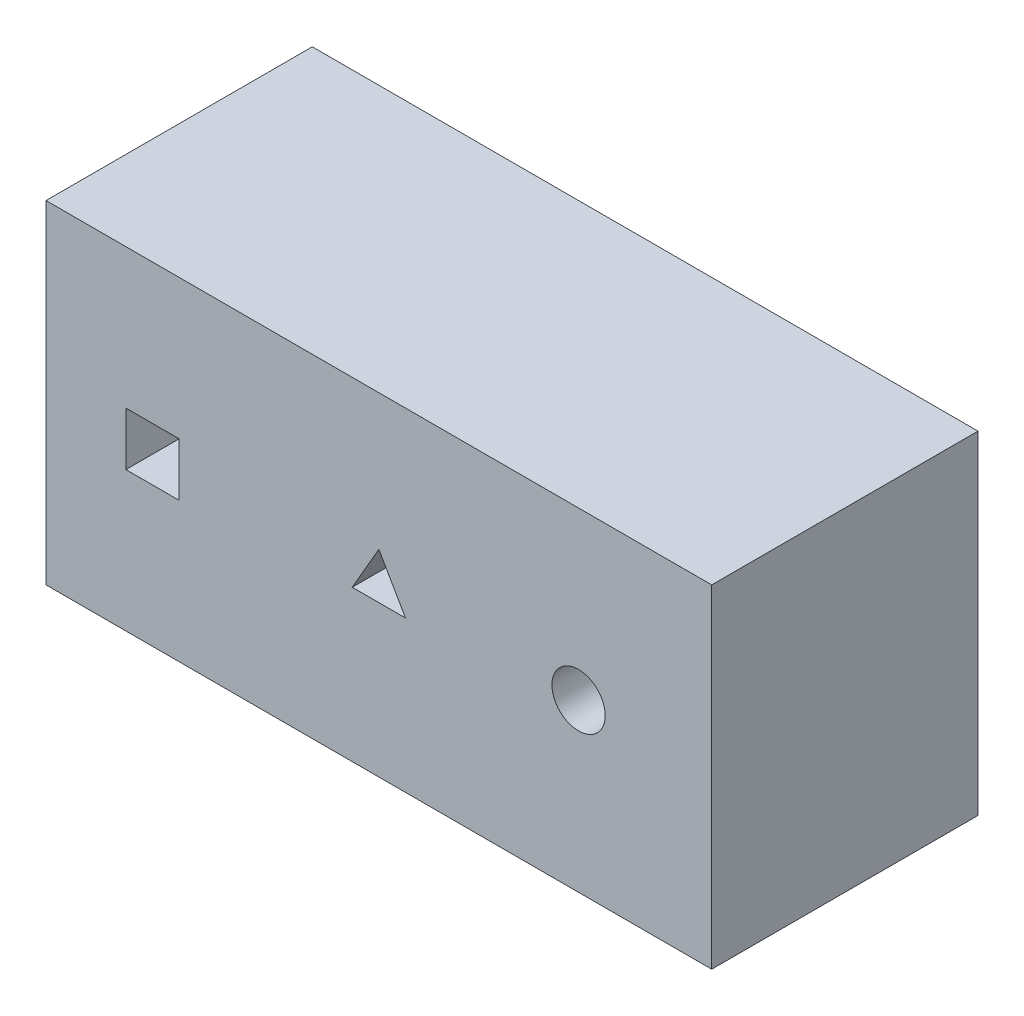
from build123d import *

# Parameters (mm, degrees)
SKETCH1_W           = 250
SKETCH1_H           = 125
SKETCH1_W_2         = 230
SKETCH1_H_2         = 115
BOSS_EXTRUDE1_DEPTH = 100
SKETCH3_W           = 250
SKETCH3_H           = 125
SKETCH3_W_2         = 230
SKETCH3_H_2         = 115
SKETCH3_R           = 10
SKETCH3_W_3         = 20
SKETCH3_H_3         = 20
BOSS_EXTRUDE4_DEPTH = 100


with BuildPart() as part:
    # Sketch1 → Boss-Extrude1 (new body)
    with BuildSketch(Plane.XY):
        Rectangle(SKETCH1_W, SKETCH1_H)
        Rectangle(SKETCH1_W_2, SKETCH1_H_2, mode=Mode.SUBTRACT)
    extrude(amount=BOSS_EXTRUDE1_DEPTH)

    # Sketch3 → Boss-Extrude4 (add)
    # profile 1 of 2: a face of its own
    with BuildSketch(Plane.XY.offset(100)):
        Rectangle(SKETCH3_W, SKETCH3_H)
        Rectangle(SKETCH3_W_2, SKETCH3_H_2, mode=Mode.SUBTRACT)
    # profile 2 of 2: a face of its own
    with BuildSketch(Plane.XY.offset(100)):
        Rectangle(SKETCH3_W_2, SKETCH3_H_2)
        with Locations((75, 0)):
            Circle(SKETCH3_R, mode=Mode.SUBTRACT)
        with Locations((-85, 0)):
            Rectangle(SKETCH3_W_3, SKETCH3_H_3, mode=Mode.SUBTRACT)
        Polygon((0, 11.547005384), (10, -5.773502692), (-10, -5.773502692), align=None, mode=Mode.SUBTRACT)
    extrude(amount=-BOSS_EXTRUDE4_DEPTH)


solid = part.part
